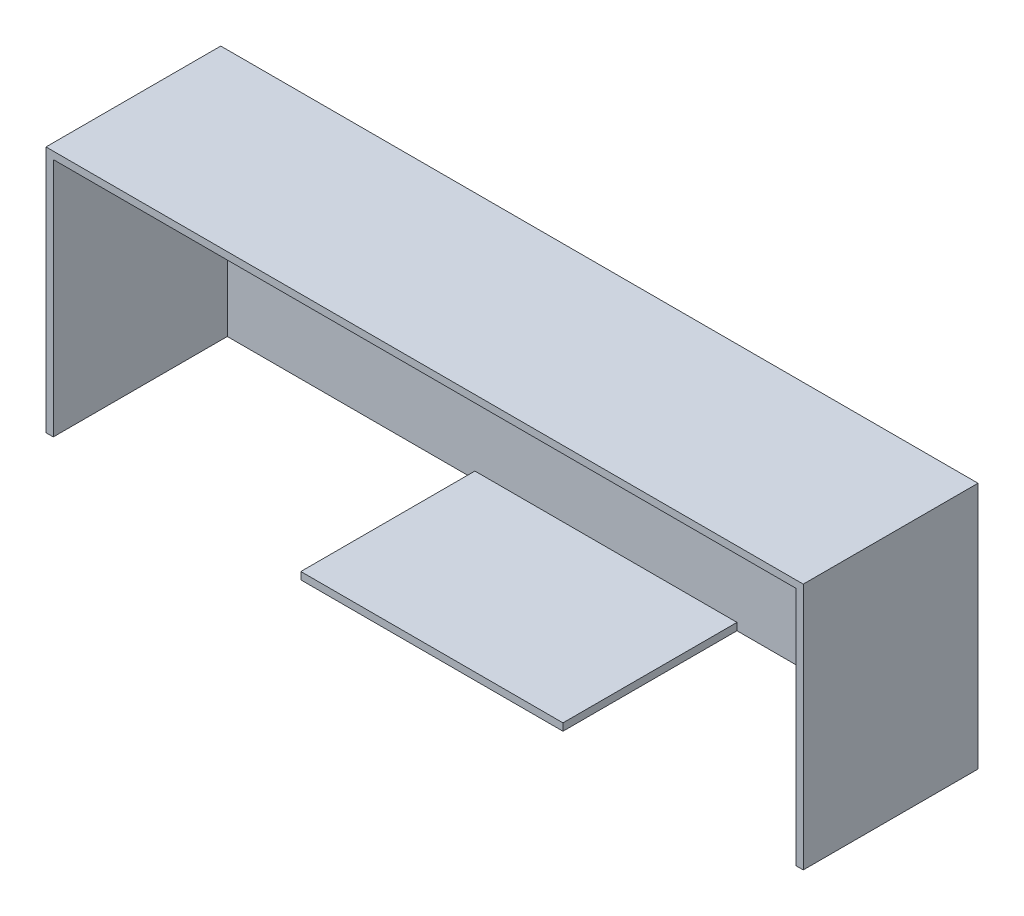
from build123d import *

# Parameters (mm, degrees)
BOSS_EXTRUDE1_DEPTH   = 152.4
SKETCH1_W             = 228.6
SKETCH1_H             = 6.35
BOSS_EXTRUDE1_2_DEPTH = 152.4
SKETCH3_W             = 647.7
SKETCH3_H             = 209.55
BOSS_EXTRUDE2_DEPTH   = 0.635


with BuildPart() as part:
    # Sketch1 → Boss-Extrude1 (new body)
    with BuildSketch(Plane.XY):
        Polygon((-94.045128316, 6.35), (566.354871684, 6.35), (566.354871684, -209.55), (560.004871684, -209.55), (560.004871684, 0), (-87.695128316, 0), (-87.695128316, -209.55), (-94.045128316, -209.55), align=None)
    extrude(amount=BOSS_EXTRUDE1_DEPTH)



with BuildPart() as body_2:
    # Sketch1 → Boss-Extrude1 2 (new body)
    with BuildSketch(Plane.XY):
        with Locations((242.504871684, -206.375)):
            Rectangle(SKETCH1_W, SKETCH1_H)
    extrude(amount=BOSS_EXTRUDE1_2_DEPTH)


with BuildPart() as part_1:
    add(part.part)

    add(body_2.part)  # Boss-Extrude2 merges body 2
    # Sketch3 → Boss-Extrude2 (add)
    with BuildSketch(Plane(origin=(0, 0, 0), x_dir=(-1, 0, 0), z_dir=(0, 0, -1))):
        with Locations((-236.154871684, -104.775)):
            Rectangle(SKETCH3_W, SKETCH3_H)
    extrude(amount=-BOSS_EXTRUDE2_DEPTH)


solid = part_1.part
